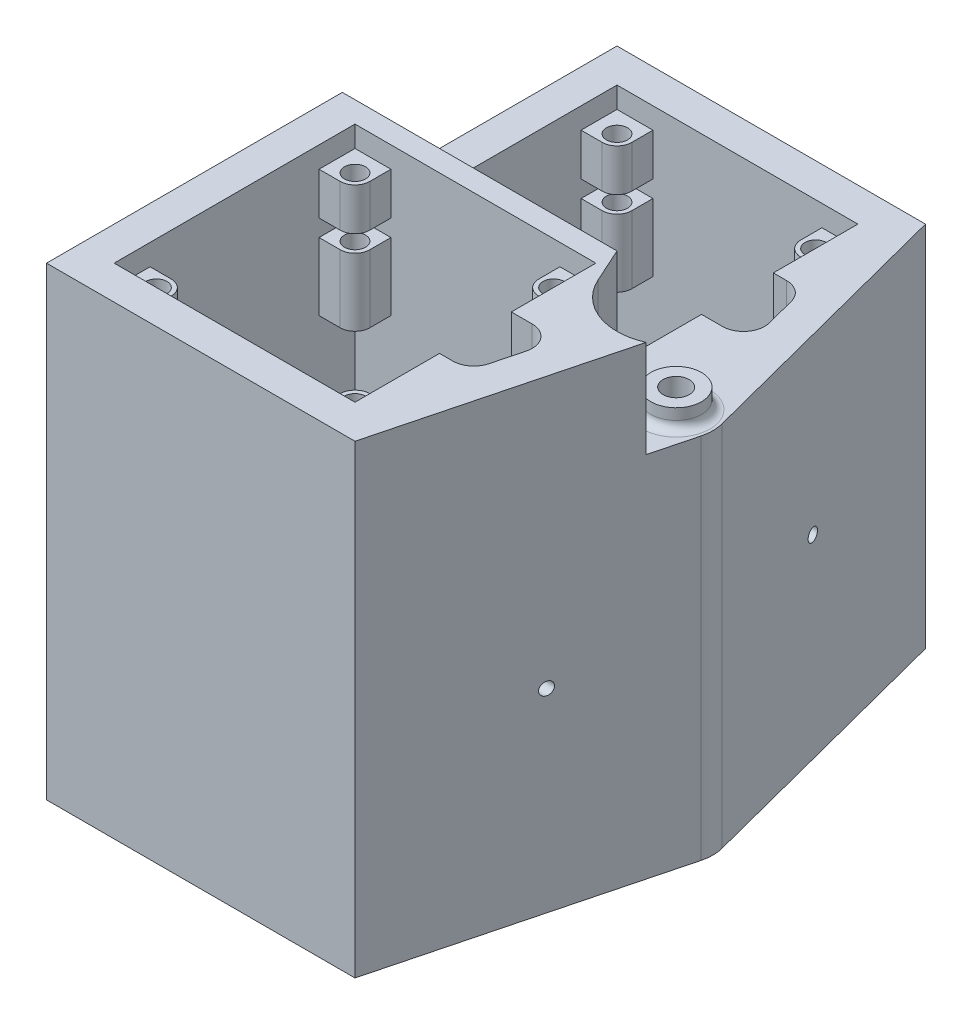
from build123d import *

# Parameters (mm, degrees)
SALIENTE_EXTRUIR1_DEPTH     = 110
CORTAR_EXTRUIR1_DEPTH       = 102
REDONDEO2_R                 = 5
CROQUIS3_W                  = 57
CROQUIS3_H                  = 57
CORTAR_EXTRUIR2_DEPTH       = 5
CROQUIS4_R                  = 6
CORTAR_EXTRUIR3_DEPTH       = 100
CROQUIS5_R                  = 3.1
CORTAR_EXTRUIR4_DEPTH       = 100
CORTAR_EXTRUIR5_START       = -32
CORTAR_EXTRUIR5_DEPTH       = 32
SALIENTE_EXTRUIR2_DEPTH     = 23
CORTAR_EXTRUIR6_DEPTH       = 102
CROQUIS10_W                 = 57
CROQUIS10_H                 = 57
CORTAR_EXTRUIR7_DEPTH       = 5
CORTAR_EXTRUIR8_DEPTH       = 189.690884782
CORTAR_EXTRUIR8_DEPTH_BACK  = 3
CROQUIS11_R                 = 63
CROQUIS12_R                 = 55
CORTAR_EXTRUIR9_DEPTH       = 13
CROQUIS13_R                 = 1.75
CORTAR_EXTRUIR10_DEPTH      = 14
CROQUIS14_R                 = 2.25
CORTAR_EXTRUIR11_DEPTH      = 5
MATRIZC1_COUNT              = 6
CROQUIS17_R                 = 2.5
CORTAR_EXTRUIR12_DEPTH      = 30
CROQUIS16_R                 = 2.5
CORTAR_EXTRUIR14_DEPTH      = 30
CORTAR_EXTRUIR16_DEPTH      = 202.102585802
CORTAR_EXTRUIR16_DEPTH_BACK = 202.102585802
CROQUIS22_R                 = 3
CORTAR_EXTRUIR17_START      = 30
CROQUIS23_R                 = 5
CORTAR_EXTRUIR17_DEPTH      = 193.025336429
CORTAR_EXTRUIR18_DEPTH      = 195.139769281
CROQUIS25_W                 = 40
CROQUIS25_H                 = 15
CORTAR_EXTRUIR19_DEPTH      = 223.025336392
CORTAR_EXTRUIR20_DEPTH      = 193.185457306
CORTAR_EXTRUIR21_REACH      = 224.025
CORTAR_EXTRUIR22_START      = 15
CORTAR_EXTRUIR22_DEPTH      = 15
CORTAR_EXTRUIR24_START      = -87.259259
CROQUIS29_W                 = 40
CROQUIS29_H                 = 15
CORTAR_EXTRUIR24_DEPTH      = 31.841835
CORTAR_EXTRUIR25_REACH      = 206.964
CROQUIS31_W                 = 56
CROQUIS31_H                 = 15
CORTAR_EXTRUIR26_DEPTH      = 3
CROQUIS32_R                 = 1.5
CORTAR_EXTRUIR27_DEPTH      = 10
CROQUIS33_R                 = 2.5
CORTAR_EXTRUIR28_DEPTH      = 195.139769239
CROQUIS34_R                 = 4.25
CORTAR_EXTRUIR29_DEPTH      = 5
CORTAR_EXTRUIR30_REACH      = 265.101
CROQUIS35_R                 = 2.5
CROQUIS36_R                 = 4.25
CORTAR_EXTRUIR31_DEPTH      = 5
SALIENTE_EXTRUIR3_START     = 4.6
CROQUIS38_R                 = 6
CROQUIS38_R_2               = 3.1
SALIENTE_EXTRUIR3_DEPTH     = 4.6
REDONDEO3_R                 = 2
CORTAR_EXTRUIR33_START      = -4
CORTAR_EXTRUIR33_DEPTH      = 2.2
CORTAR_EXTRUIR34_REACH      = 208.473
CORTAR_EXTRUIR35_START      = -30
CROQUIS41_W                 = 57
CROQUIS41_H                 = 57
CORTAR_EXTRUIR35_DEPTH      = 67
CORTAR_EXTRUIR36_START      = -84.320045
CROQUIS42_R                 = 1.5
CORTAR_EXTRUIR36_DEPTH      = 25.436686
CORTAR_EXTRUIR37_DEPTH      = 12
CROQUIS44_R                 = 3
CORTAR_EXTRUIR38_DEPTH      = 65
CORTAR_EXTRUIR39_DEPTH      = 223.025336392
CORTAR_EXTRUIR40_DEPTH      = 23
CORTAR_EXTRUIR41_DEPTH      = 97
CORTAR_EXTRUIR42_START      = -30
CROQUIS48_W                 = 57
CROQUIS48_H                 = 57
CORTAR_EXTRUIR42_DEPTH      = 67
CORTAR_EXTRUIR43_START      = -10
CROQUIS49_W                 = 57
CROQUIS49_H                 = 57
CORTAR_EXTRUIR43_DEPTH      = 4
CORTAR_EXTRUIR44_START      = -10
CORTAR_EXTRUIR44_DEPTH      = 4


with BuildPart() as part:
    # Croquis1 → Saliente-Extruir1 (new body)
    with BuildSketch(Plane(origin=(0, 0, 0), x_dir=(1, 0, 0), z_dir=(0, 1, 0))):
        with BuildLine():
            Line((-158, 67.5), (0, 67.5))
            ThreePointArc((0, 67.5), (67.5, 0), (0, -67.5))
            Line((0, -67.5), (-158, -67.5))
            Line((-158, -67.5), (-158, 67.5))
        make_face()
    extrude(amount=SALIENTE_EXTRUIR1_DEPTH)

    # Croquis2 → Cortar-Extruir1 (cut)
    with BuildSketch(Plane(origin=(0, 110, 0), x_dir=(1, 0, 0), z_dir=(0, 1, 0))):
        Polygon((-140, 59.5), (-103, 59.5), (-103, 49.5), (-93, 49.5), (-93, 12.5), (-103, 12.5), (-103, 2.5), (-140, 2.5), (-140, 12.5), (-150, 12.5), (-150, 49.5), (-140, 49.5), align=None)
    extrude(amount=-CORTAR_EXTRUIR1_DEPTH, mode=Mode.SUBTRACT)

    # Redondeo2
    redondeo2_edges = [part.edges().sort_by_distance(p)[0] for p in [
        (-140, 59, -12.5),
        (-140, 59, -49.5),
        (-103, 59, -49.5),
        (-103, 59, -12.5),
    ]]
    fillet(redondeo2_edges, radius=REDONDEO2_R)

    # Croquis3 → Cortar-Extruir2 (cut)
    with BuildSketch(Plane(origin=(0, 110, 0), x_dir=(1, 0, 0), z_dir=(0, 1, 0))):
        with Locations((-121.5, 31)):
            Rectangle(CROQUIS3_W, CROQUIS3_H)
    extrude(amount=-CORTAR_EXTRUIR2_DEPTH, mode=Mode.SUBTRACT)

    # Croquis4 → Cortar-Extruir3 (cut)
    with BuildSketch(Plane(origin=(0, 110, 0), x_dir=(1, 0, 0), z_dir=(0, 1, 0))):
        with Locations(Location((0, 0, 0), (0, 0, 270))):
            Circle(CROQUIS4_R)
    extrude(amount=-CORTAR_EXTRUIR3_DEPTH, mode=Mode.SUBTRACT)

    # Croquis5 → Cortar-Extruir4 (cut)
    with BuildSketch(Plane(origin=(0, 110, 0), x_dir=(1, 0, 0), z_dir=(0, 1, 0))):
        with Locations(Location((-76.5, 0, 0), (0, 0, 270))):
            Circle(CROQUIS5_R)
    extrude(amount=-CORTAR_EXTRUIR4_DEPTH, mode=Mode.SUBTRACT)

    # Croquis6 → Cortar-Extruir5 (cut)
    with BuildSketch(Plane(origin=(0, 110, 0), x_dir=(1, 0, 0), z_dir=(0, 1, 0)).offset(CORTAR_EXTRUIR5_START)):
        with BuildLine():
            Line((-68.150642634, 2.509621588), (-85, 67.5))
            Line((-85, 67.5), (0, 67.5))
            ThreePointArc((0, 67.5), (67.5, 0), (0, -67.5))
            Line((0, -67.5), (-85, -67.5))
            Line((-85, -67.5), (-68.150642634, -2.509621588))
            ThreePointArc((-68.150642634, -2.509621588), (-67.830611616, 0), (-68.150642634, 2.509621588))
        make_face()
    extrude(amount=CORTAR_EXTRUIR5_DEPTH, mode=Mode.SUBTRACT)

    # Croquis7 → Saliente-Extruir2 (add)
    with BuildSketch(Plane(origin=(0, 110, 0), x_dir=(1, 0, 0), z_dir=(0, 1, 0))):
        with BuildLine():
            Line((-70.817153658, -12.794735536), (-85, -67.5))
            Line((-85, -67.5), (-158, -67.5))
            Line((-158, -67.5), (-158, 2.5))
            Line((-158, 2.5), (-93, 2.5))
            Line((-93, 2.5), (-89.253692234, -5.774368745))
            ThreePointArc((-89.253692234, -5.774368745), (-81.482027989, -13.083554453), (-70.817153658, -12.794735536))
        make_face()
    extrude(amount=SALIENTE_EXTRUIR2_DEPTH)

    # Croquis8 → Cortar-Extruir6 (cut)
    with BuildSketch(Plane(origin=(0, 133, 0), x_dir=(1, 0, 0), z_dir=(0, 1, 0))):
        with BuildLine():
            Line((-103, -59.5), (-140, -59.5))
            Line((-140, -59.5), (-140, -54.5))
            ThreePointArc((-140, -54.5), (-141.464466094, -50.964466094), (-145, -49.5))
            Line((-145, -49.5), (-150, -49.5))
            Line((-150, -49.5), (-150, -12.5))
            Line((-150, -12.5), (-145, -12.5))
            ThreePointArc((-145, -12.5), (-141.464466094, -11.035533906), (-140, -7.5))
            Line((-140, -7.5), (-140, -2.5))
            Line((-140, -2.5), (-103, -2.5))
            Line((-103, -2.5), (-103, -7.5))
            ThreePointArc((-103, -7.5), (-101.535533906, -11.035533906), (-98, -12.5))
            Line((-98, -12.5), (-93, -12.5))
            Line((-93, -12.5), (-93, -49.5))
            Line((-93, -49.5), (-98, -49.5))
            ThreePointArc((-98, -49.5), (-101.535533906, -50.964466094), (-103, -54.5))
            Line((-103, -54.5), (-103, -59.5))
        make_face()
    extrude(amount=-CORTAR_EXTRUIR6_DEPTH, mode=Mode.SUBTRACT)

    # Croquis10 → Cortar-Extruir7 (cut)
    with BuildSketch(Plane(origin=(0, 133, 0), x_dir=(1, 0, 0), z_dir=(0, 1, 0))):
        with Locations((-121.5, -31)):
            Rectangle(CROQUIS10_W, CROQUIS10_H)
    extrude(amount=-CORTAR_EXTRUIR7_DEPTH, mode=Mode.SUBTRACT)

    # Croquis11 → Cortar-Extruir8 (cut, two sides: drawn at the far end of the back side and taken through both)
    with BuildSketch(Plane(origin=(0, 78, 0), x_dir=(1, 0, 0), z_dir=(0, 1, 0)).offset(-CORTAR_EXTRUIR8_DEPTH_BACK)):
        with Locations(Location((0, 0, 0), (0, 0, 270))):
            Circle(CROQUIS11_R)
    extrude(amount=CORTAR_EXTRUIR8_DEPTH + CORTAR_EXTRUIR8_DEPTH_BACK, mode=Mode.SUBTRACT)

    # Croquis12 → Cortar-Extruir9 (cut)
    with BuildSketch(Plane(origin=(0, 78, 0), x_dir=(1, 0, 0), z_dir=(0, 1, 0))):
        with Locations(Location((0, 0, 0), (0, 0, 270))):
            Circle(CROQUIS12_R)
    extrude(amount=-CORTAR_EXTRUIR9_DEPTH, mode=Mode.SUBTRACT)

    # Croquis13 → Cortar-Extruir10 (cut)
    with BuildSketch(Plane(origin=(0, 65, 0), x_dir=(1, 0, 0), z_dir=(0, 1, 0))):
        with Locations(Location((-37.5, 0, 0), (0, 0, 270))):
            Circle(CROQUIS13_R)
    cortar_extruir10 = extrude(amount=-CORTAR_EXTRUIR10_DEPTH, mode=Mode.SUBTRACT)

    # Croquis14 → Cortar-Extruir11 (cut)
    with BuildSketch(Plane(origin=(0, 65, 0), x_dir=(1, 0, 0), z_dir=(0, 1, 0))):
        with Locations(Location((-37.5, 0, 0), (0, 0, 270))):
            Circle(CROQUIS14_R)
    cortar_extruir11 = extrude(amount=-CORTAR_EXTRUIR11_DEPTH, mode=Mode.SUBTRACT)

    # MatrizC1: Cortar-Extruir10, Cortar-Extruir11 ×6 about axis
    matrizc1_axis = Axis((0, 0, 0), (0, 1, 0))
    add([cortar_extruir10.rotate(matrizc1_axis, i * 360 / MATRIZC1_COUNT) for i in range(1, MATRIZC1_COUNT)], mode=Mode.SUBTRACT)
    add([cortar_extruir11.rotate(matrizc1_axis, i * 360 / MATRIZC1_COUNT) for i in range(1, MATRIZC1_COUNT)], mode=Mode.SUBTRACT)

    # Croquis17 → Cortar-Extruir12 (cut)
    with BuildSketch(Plane(origin=(0, 133, 0), x_dir=(1, 0, 0), z_dir=(0, 1, 0))):
        with Locations(Location((-145, -7.5, 0), (0, 0, 270))):
            Circle(CROQUIS17_R)
        with Locations(Location((-98, -7.5, 0), (0, 0, 270))):
            Circle(CROQUIS17_R)
        with Locations(Location((-145, -54.5, 0), (0, 0, 270))):
            Circle(CROQUIS17_R)
        with Locations(Location((-98, -54.5, 0), (0, 0, 270))):
            Circle(CROQUIS17_R)
    extrude(amount=-CORTAR_EXTRUIR12_DEPTH, mode=Mode.SUBTRACT)

    # Croquis16 → Cortar-Extruir14 (cut)
    with BuildSketch(Plane(origin=(0, 110, 0), x_dir=(1, 0, 0), z_dir=(0, 1, 0))):
        with Locations(Location((-145, 54.5, 0), (0, 0, 270))):
            Circle(CROQUIS16_R)
        with Locations(Location((-98, 54.5, 0), (0, 0, 270))):
            Circle(CROQUIS16_R)
        with Locations(Location((-145, 7.5, 0), (0, 0, 270))):
            Circle(CROQUIS16_R)
        with Locations(Location((-98, 7.5, 0), (0, 0, 270))):
            Circle(CROQUIS16_R)
    extrude(amount=-CORTAR_EXTRUIR14_DEPTH, mode=Mode.SUBTRACT)

    # Barrer1: sweep along a path in Croquis20
    with BuildLine(Plane.XZ) as barrer1_path:
        Line((-158, -67.5), (0, -67.5))
        ThreePointArc((0, -67.5), (67.5, 0), (0, 67.5))
        Line((0, 67.5), (-158, 67.5))
    # Croquis21 → Barrer1 (sweep)
    with BuildSketch(Plane(origin=(-158, 0, 0), x_dir=(0, 0, -1), z_dir=(1, 0, 0))):
        with BuildLine():
            Line((-67.5, 0), (-81.5, 0))
            Line((-81.5, 0), (-81.5, 37.259500921))
            ThreePointArc((-81.5, 37.259500921), (-81.351889846, 38.974221441), (-80.911946708, 40.638148457))
            Line((-80.911946708, 40.638148457), (-67.5, 78))
            Line((-67.5, 78), (-67.5, 39))
            Line((-67.5, 39), (-67.5, 0))
        make_face()
    sweep(path=barrer1_path.line)

    # Croquis22 → Cortar-Extruir16 (cut, two sides: drawn at the far end of the back side and taken through both)
    with BuildSketch(Plane(origin=(0, 39, 0), x_dir=(-1, 0, 0), z_dir=(0, -1, 0)).offset(-CORTAR_EXTRUIR16_DEPTH_BACK)):
        with Locations(Location((118.5, 74.205973354, 0), (0, 0, 90))):
            Circle(CROQUIS22_R)
        with Locations(Location((39.5, 74.205973354, 0), (0, 0, 90))):
            Circle(CROQUIS22_R)
        with Locations(Location((-52.471546963, 52.471546963, 0), (0, 0, 90))):
            Circle(CROQUIS22_R)
        with Locations(Location((118.5, -74.205973354, 0), (0, 0, 270))):
            Circle(CROQUIS22_R)
        with Locations(Location((39.5, -74.205973354, 0), (0, 0, 270))):
            Circle(CROQUIS22_R)
        with Locations(Location((-52.471546963, -52.471546963, 0), (0, 0, 225))):
            Circle(CROQUIS22_R)
    extrude(amount=CORTAR_EXTRUIR16_DEPTH + CORTAR_EXTRUIR16_DEPTH_BACK, mode=Mode.SUBTRACT)

    # Croquis23 → Cortar-Extruir17 (cut, through all)
    with BuildSketch(Plane(origin=(0, 0, 0), x_dir=(1, 0, 0), z_dir=(0, 1, 0)).offset(CORTAR_EXTRUIR17_START)):
        with Locations(Location((-118.5, 74.205973354, 0), (0, 0, 90))):
            Circle(CROQUIS23_R)
        with Locations(Location((-39.5, 74.205973354, 0), (0, 0, 90))):
            Circle(CROQUIS23_R)
        with Locations(Location((52.471546963, 52.471546963, 0), (0, 0, 85.474739491))):
            Circle(CROQUIS23_R)
        with Locations(Location((52.471546963, -52.471546963, 0), (0, 0, 90))):
            Circle(CROQUIS23_R)
        with Locations(Location((-39.5, -74.205973354, 0), (0, 0, 90))):
            Circle(CROQUIS23_R)
        with Locations(Location((-118.5, -74.205973354, 0), (0, 0, 90))):
            Circle(CROQUIS23_R)
    extrude(amount=CORTAR_EXTRUIR17_DEPTH, mode=Mode.SUBTRACT)

    # Croquis24 → Cortar-Extruir18 (cut, through all)
    with BuildSketch(Plane(origin=(0, 78, 0), x_dir=(1, 0, 0), z_dir=(0, 1, 0))):
        with BuildLine():
            Line((0, 67.5), (0, 96.298683862))
            ThreePointArc((0, 96.298683862), (96.298683862, 0), (0, -96.298683862))
            Line((0, -96.298683862), (0, -67.5))
            ThreePointArc((0, -67.5), (-67.5, 0), (0, 67.5))
        make_face()
    extrude(amount=-CORTAR_EXTRUIR18_DEPTH, mode=Mode.SUBTRACT)

    # Croquis25 → Cortar-Extruir19 (cut, through all)
    with BuildSketch(Plane.ZY.offset(158)):
        with Locations((32.5, 15.5)):
            Rectangle(CROQUIS25_W, CROQUIS25_H)
    extrude(amount=-CORTAR_EXTRUIR19_DEPTH, mode=Mode.SUBTRACT)

    # Croquis26 → Cortar-Extruir20 (cut, through all)
    with BuildSketch(Plane(origin=(0, 60, 0), x_dir=(1, 0, 0), z_dir=(0, 1, 0))):
        with BuildLine():
            Line((-85, -67.5), (0, -67.5))
            Line((0, -67.5), (0, 67.5))
            Line((0, 67.5), (-85, 67.5))
            Line((-85, 67.5), (-68.150642634, 2.509621588))
            ThreePointArc((-68.150642634, 2.509621588), (-67.830611616, 0), (-68.150642634, -2.509621588))
            Line((-68.150642634, -2.509621588), (-70.817153658, -12.794735536))
            Line((-70.817153658, -12.794735536), (-85, -67.5))
        make_face()
    extrude(amount=-CORTAR_EXTRUIR20_DEPTH, mode=Mode.SUBTRACT)

    # Cortar-Extruir21: up to this face of the body (flat: up to its plane)
    cortar_extruir21_end = Plane(part.part.faces().sort_by_distance((-121.5, 8, -31))[0])
    # Croquis27 → Cortar-Extruir21 (cut, up to the picked face)
    with BuildSketch(Plane(origin=(0, 133, 0), x_dir=(1, 0, 0), z_dir=(0, 1, 0)), mode=Mode.PRIVATE) as cortar_extruir21_sk1:
        with BuildLine():
            Line((-93, -39.5), (-89.874239545, -39.5))
            ThreePointArc((-89.874239545, -39.5), (-86.814341995, -38.454368089), (-85.034255054, -35.754810794))
            Line((-85.034255054, -35.754810794), (-83.219440239, -28.754810794))
            ThreePointArc((-83.219440239, -28.754810794), (-84.105056641, -24.44010245), (-88.05942473, -22.5))
            Line((-88.05942473, -22.5), (-93, -22.5))
            Line((-93, -22.5), (-93, -39.5))
        make_face()
    cortar_extruir21_tool1 = split(extrude(cortar_extruir21_sk1.sketch, amount=-CORTAR_EXTRUIR21_REACH, mode=Mode.PRIVATE), bisect_by=cortar_extruir21_end, keep=Keep.BOTH, mode=Mode.PRIVATE)
    # Croquis27 → Cortar-Extruir21 (cut, up to the picked face)
    with BuildSketch(Plane(origin=(0, 133, 0), x_dir=(1, 0, 0), z_dir=(0, 1, 0)), mode=Mode.PRIVATE) as cortar_extruir21_sk2:
        with BuildLine():
            Line((-93, 22.5), (-93, 39.5))
            Line((-93, 39.5), (-89.874239545, 39.5))
            ThreePointArc((-89.874239545, 39.5), (-86.814341995, 38.454368089), (-85.034255054, 35.754810794))
            Line((-85.034255054, 35.754810794), (-83.219440239, 28.754810794))
            ThreePointArc((-83.219440239, 28.754810794), (-84.105056641, 24.44010245), (-88.05942473, 22.5))
            Line((-88.05942473, 22.5), (-93, 22.5))
        make_face()
    cortar_extruir21_tool2 = split(extrude(cortar_extruir21_sk2.sketch, amount=-CORTAR_EXTRUIR21_REACH, mode=Mode.PRIVATE), bisect_by=cortar_extruir21_end, keep=Keep.BOTH, mode=Mode.PRIVATE)
    add(cortar_extruir21_tool1.solids().sort_by(Axis((-88.665419, 133, 30.573819), (0, -1, 0)))[0], mode=Mode.SUBTRACT)
    add(cortar_extruir21_tool2.solids().sort_by(Axis((-88.665419, 133, -30.573819), (0, -1, 0)))[0], mode=Mode.SUBTRACT)

    # Croquis28 → Cortar-Extruir22 (cut)
    with BuildSketch(Plane(origin=(0, 8, 0), x_dir=(1, 0, 0), z_dir=(0, 1, 0)).offset(CORTAR_EXTRUIR22_START)):
        with BuildLine():
            Line((-83.219440239, 28.754810794), (-76.415131926, 2.509621588))
            ThreePointArc((-76.415131926, 2.509621588), (-76.095100908, 0), (-76.415131926, -2.509621588))
            Line((-76.415131926, -2.509621588), (-83.219440239, -28.754810794))
            Line((-83.219440239, -28.754810794), (-85.034255054, -35.754810794))
            ThreePointArc((-85.034255054, -35.754810794), (-86.814341995, -38.454368089), (-89.874239545, -39.5))
            Line((-89.874239545, -39.5), (-93, -39.5))
            Line((-93, -39.5), (-93, 39.5))
            Line((-93, 39.5), (-89.874239545, 39.5))
            ThreePointArc((-89.874239545, 39.5), (-86.814341995, 38.454368089), (-85.034255054, 35.754810794))
            Line((-85.034255054, 35.754810794), (-83.219440239, 28.754810794))
        make_face()
    extrude(amount=-CORTAR_EXTRUIR22_DEPTH, mode=Mode.SUBTRACT)

    # Croquis29 → Cortar-Extruir24 (cut)
    with BuildSketch(Plane.ZY.offset(158).offset(CORTAR_EXTRUIR24_START)):
        with Locations((-32.5, 15.5)):
            Rectangle(CROQUIS29_W, CROQUIS29_H)
    extrude(amount=CORTAR_EXTRUIR24_DEPTH, mode=Mode.SUBTRACT)

    # Croquis30 → Cortar-Extruir25 (cut, up to next)
    with BuildSketch(Plane(origin=(0, 31, 0), x_dir=(1, 0, 0), z_dir=(0, 1, 0)), mode=Mode.PRIVATE) as cortar_extruir25_sk1:
        with BuildLine():
            Line((-132, -52.5), (-111, -52.5))
            ThreePointArc((-111, -52.5), (-105.343145751, -50.156854249), (-103, -44.5))
            Line((-103, -44.5), (-103, -20.5))
            ThreePointArc((-103, -20.5), (-105.343145751, -14.843145751), (-111, -12.5))
            Line((-111, -12.5), (-132, -12.5))
            ThreePointArc((-132, -12.5), (-137.656854249, -14.843145751), (-140, -20.5))
            Line((-140, -20.5), (-140, -44.5))
            ThreePointArc((-140, -44.5), (-137.656854249, -50.156854249), (-132, -52.5))
        make_face()
    cortar_extruir25_tool1 = extrude(cortar_extruir25_sk1.sketch, amount=-CORTAR_EXTRUIR25_REACH, mode=Mode.PRIVATE) & part.part
    add(cortar_extruir25_tool1.solids().sort_by_distance((-121.5, 31, 32.5))[0], mode=Mode.SUBTRACT)

    # Croquis31 → Cortar-Extruir26 (cut)
    with BuildSketch(Plane.ZY.offset(158)):
        with Locations((32.5, 15.5)):
            Rectangle(CROQUIS31_W, CROQUIS31_H)
    extrude(amount=-CORTAR_EXTRUIR26_DEPTH, mode=Mode.SUBTRACT)

    # Croquis32 → Cortar-Extruir27 (cut)
    with BuildSketch(Plane.ZY.offset(155)):
        with Locations((8.5, 15.5)):
            Circle(CROQUIS32_R)
        with Locations(Location((56.5, 15.5, 0), (0, 0, 180))):
            Circle(CROQUIS32_R)
    extrude(amount=-CORTAR_EXTRUIR27_DEPTH, mode=Mode.SUBTRACT)

    # Croquis33 → Cortar-Extruir28 (cut, through all)
    with BuildSketch(Plane(origin=(0, 78, 0), x_dir=(1, 0, 0), z_dir=(0, 1, 0))):
        with Locations(Location((-70.010673469, 57.5, 0), (0, 0, 270))):
            Circle(CROQUIS33_R)
        with Locations(Location((-65.344006802, 39.5, 0), (0, 0, 270))):
            Circle(CROQUIS33_R)
        with Locations(Location((-65.344006802, -39.5, 0), (0, 0, 270))):
            Circle(CROQUIS33_R)
        with Locations(Location((-70.010673469, -57.5, 0), (0, 0, 270))):
            Circle(CROQUIS33_R)
    extrude(amount=-CORTAR_EXTRUIR28_DEPTH, mode=Mode.SUBTRACT)

    # Croquis34 → Cortar-Extruir29 (cut)
    with BuildSketch(Plane(origin=(0, 78, 0), x_dir=(1, 0, 0), z_dir=(0, 1, 0))):
        with Locations(Location((-70.010673469, 57.5, 0), (0, 0, 270))):
            Circle(CROQUIS34_R)
        with Locations(Location((-65.344006802, 39.5, 0), (0, 0, 270))):
            Circle(CROQUIS34_R)
        with Locations(Location((-65.344006802, -39.5, 0), (0, 0, 270))):
            Circle(CROQUIS34_R)
        with Locations(Location((-70.010673469, -57.5, 0), (0, 0, 270))):
            Circle(CROQUIS34_R)
    extrude(amount=-CORTAR_EXTRUIR29_DEPTH, mode=Mode.SUBTRACT)

    # Croquis35 → Cortar-Extruir30 (cut, up to next)
    with BuildSketch(Plane(origin=(0, 0, -81.5), x_dir=(-1, 0, 0), z_dir=(0, 0, -1)), mode=Mode.PRIVATE) as cortar_extruir30_sk1:
        with Locations((12, 28)):
            Circle(CROQUIS35_R)
    cortar_extruir30_tool1 = extrude(cortar_extruir30_sk1.sketch, amount=-CORTAR_EXTRUIR30_REACH, mode=Mode.PRIVATE) & part.part
    # Croquis35 → Cortar-Extruir30 (cut, up to next)
    with BuildSketch(Plane(origin=(0, 0, -81.5), x_dir=(-1, 0, 0), z_dir=(0, 0, -1)), mode=Mode.PRIVATE) as cortar_extruir30_sk2:
        with Locations((12, 10)):
            Circle(CROQUIS35_R)
    cortar_extruir30_tool2 = extrude(cortar_extruir30_sk2.sketch, amount=-CORTAR_EXTRUIR30_REACH, mode=Mode.PRIVATE) & part.part
    cortar_extruir30_1 = cortar_extruir30_tool1.solids().sort_by_distance((-12, 28, -81.5))[0]
    add(cortar_extruir30_1, mode=Mode.SUBTRACT)
    cortar_extruir30_2 = cortar_extruir30_tool2.solids().sort_by_distance((-12, 10, -81.5))[0]
    add(cortar_extruir30_2, mode=Mode.SUBTRACT)
    cortar_extruir30 = cortar_extruir30_1 + cortar_extruir30_2  # Cortar-Extruir30 as one shape, for the pattern or mirror that repeats it

    # Croquis36 → Cortar-Extruir31 (cut)
    with BuildSketch(Plane(origin=(0, 0, -81.5), x_dir=(-1, 0, 0), z_dir=(0, 0, -1))):
        with Locations((12, 28)):
            Circle(CROQUIS36_R)
        with Locations((12, 10)):
            Circle(CROQUIS36_R)
    cortar_extruir31 = extrude(amount=-CORTAR_EXTRUIR31_DEPTH, mode=Mode.SUBTRACT)

    # Simetría2: Cortar-Extruir30, Cortar-Extruir31 across plane
    add(cortar_extruir30.mirror(Plane(origin=(0, 0, 0), x_dir=(1, 0, 0), z_dir=(0, 0, -1))), mode=Mode.SUBTRACT)
    add(cortar_extruir31.mirror(Plane(origin=(0, 0, 0), x_dir=(1, 0, 0), z_dir=(0, 0, -1))), mode=Mode.SUBTRACT)

    # Croquis38 → Saliente-Extruir3 (add)
    with BuildSketch(Plane(origin=(0, 110, 0), x_dir=(1, 0, 0), z_dir=(0, 1, 0)).offset(SALIENTE_EXTRUIR3_START)):
        with Locations(Location((-76.5, 0, 0), (0, 0, 270))):
            Circle(CROQUIS38_R)
        with Locations(Location((-76.5, 0, 0), (0, 0, 270))):
            Circle(CROQUIS38_R_2, mode=Mode.SUBTRACT)
    extrude(amount=-SALIENTE_EXTRUIR3_DEPTH)

    # Redondeo3
    redondeo3_edges = [part.edges().sort_by_distance(p)[0] for p in [
        (-76.5, 110, -6),
    ]]
    fillet(redondeo3_edges, radius=REDONDEO3_R)

    # Croquis39 → Cortar-Extruir33 (cut)
    with BuildSketch(Plane.ZY.offset(155).offset(CORTAR_EXTRUIR33_START)):
        Polygon((4.602885683, 15.5), (6.551442841, 12.125), (12.5, 12.125), (12.5, 18.875), (6.551442841, 18.875), align=None)
        Polygon((52.5, 18.875), (52.5, 12.125), (58.448557159, 12.125), (60.397114317, 15.5), (58.448557159, 18.875), align=None)
    extrude(amount=-CORTAR_EXTRUIR33_DEPTH, mode=Mode.SUBTRACT)

    # Cortar-Extruir34: up to this face of the body (flat: up to its plane)
    cortar_extruir34_end = Plane(part.part.faces().sort_by_distance((-156.5, 8, 5.983717572))[0])
    # Croquis40 → Cortar-Extruir34 (cut, up to the picked face)
    with BuildSketch(Plane(origin=(0, 105, 0), x_dir=(1, 0, 0), z_dir=(0, 1, 0)), mode=Mode.PRIVATE) as cortar_extruir34_sk1:
        with BuildLine():
            Line((-141.5, 59.5), (-141.5, 54.5))
            ThreePointArc((-141.5, 54.5), (-142.525126266, 52.025126266), (-145, 51))
            Line((-145, 51), (-150, 51))
            Line((-150, 51), (-150, 11))
            Line((-150, 11), (-145, 11))
            ThreePointArc((-145, 11), (-142.525126266, 9.974873734), (-141.5, 7.5))
            Line((-141.5, 7.5), (-141.5, 2.5))
            Line((-141.5, 2.5), (-101.5, 2.5))
            Line((-101.5, 2.5), (-101.5, 7.5))
            ThreePointArc((-101.5, 7.5), (-100.474873734, 9.974873734), (-98, 11))
            Line((-98, 11), (-93, 11))
            Line((-93, 11), (-93, 51))
            Line((-93, 51), (-98, 51))
            ThreePointArc((-98, 51), (-100.474873734, 52.025126266), (-101.5, 54.5))
            Line((-101.5, 54.5), (-101.5, 59.5))
            Line((-101.5, 59.5), (-141.5, 59.5))
        make_face()
    cortar_extruir34_tool1 = split(extrude(cortar_extruir34_sk1.sketch, amount=-CORTAR_EXTRUIR34_REACH, mode=Mode.PRIVATE), bisect_by=cortar_extruir34_end, keep=Keep.BOTH, mode=Mode.PRIVATE)
    add(cortar_extruir34_tool1.solids().sort_by(Axis((-121.5, 105, -31), (0, -1, 0)))[0], mode=Mode.SUBTRACT)

    # Croquis41 → Cortar-Extruir35 (cut)
    with BuildSketch(Plane(origin=(0, 105, 0), x_dir=(1, 0, 0), z_dir=(0, 1, 0)).offset(CORTAR_EXTRUIR35_START)):
        with Locations((-121.5, 31)):
            Rectangle(CROQUIS41_W, CROQUIS41_H)
    extrude(amount=-CORTAR_EXTRUIR35_DEPTH, mode=Mode.SUBTRACT)

    # Croquis42 → Cortar-Extruir36 (cut)
    with BuildSketch(Plane(origin=(0, 0, 0), x_dir=(0, 0, -1), z_dir=(1, 0, 0)).offset(CORTAR_EXTRUIR36_START)):
        with Locations((31.5, 69)):
            Circle(CROQUIS42_R)
        with Locations((-31.5, 69)):
            Circle(CROQUIS42_R)
    extrude(amount=CORTAR_EXTRUIR36_DEPTH, mode=Mode.SUBTRACT)

    # Croquis43 → Cortar-Extruir37 (cut)
    with BuildSketch(Plane.ZY.offset(93)):
        Polygon((-27.74722325, 69), (-29.623611625, 72.25), (-33.376388375, 72.25), (-35.25277675, 69), (-33.376388375, 65.75), (-29.623611625, 65.75), align=None)
        Polygon((29.623611625, 65.75), (27.74722325, 69), (29.623611625, 72.25), (33.376388375, 72.25), (35.25277675, 69), (33.376388375, 65.75), align=None)
    extrude(amount=-CORTAR_EXTRUIR37_DEPTH, mode=Mode.SUBTRACT)

    # Croquis44 → Cortar-Extruir38 (cut)
    with BuildSketch(Plane(origin=(0, 0, 0), x_dir=(0, 0, -1), z_dir=(1, 0, 0))):
        with Locations((31.5, 69)):
            Circle(CROQUIS44_R)
        with Locations((-31.5, 69)):
            Circle(CROQUIS44_R)
    extrude(amount=-CORTAR_EXTRUIR38_DEPTH, mode=Mode.SUBTRACT)

    # Croquis45 → Cortar-Extruir39 (cut, through all)
    with BuildSketch(Plane(origin=(0, 133, 0), x_dir=(1, 0, 0), z_dir=(0, 1, 0))):
        with BuildLine():
            Line((-158, -67.5), (-85, -67.5))
            Line((-85, -67.5), (-70.817153658, -12.794735536))
            Line((-70.817153658, -12.794735536), (-68.150642634, -2.509621588))
            ThreePointArc((-68.150642634, -2.509621588), (-67.830611616, 0), (-68.150642634, 2.509621588))
            Line((-68.150642634, 2.509621588), (-85, 67.5))
            Line((-85, 67.5), (-158, 67.5))
            add(Edge.make_bspline(
                [(-158, 67.5), (-225.196953109, 141.295845253), (92.474712565, 209.648968186), (97.38463856, -188.541965216), (-239.886153538, -136.857036311), (-158, -67.5)],
                knots=[0, 0, 0, 0, 0.321989349, 0.67256184, 1, 1, 1, 1], degree=3))
        make_face()
    extrude(amount=-CORTAR_EXTRUIR39_DEPTH, mode=Mode.SUBTRACT)

    # Croquis46 → Cortar-Extruir40 (cut)
    with BuildSketch(Plane.XZ):
        with BuildLine():
            Line((-158, -67.5), (-158, 67.5))
            Line((-158, 67.5), (-85, 67.5))
            Line((-85, 67.5), (-68.150642634, 2.509621588))
            ThreePointArc((-68.150642634, 2.509621588), (-67.830611616, 0), (-68.150642634, -2.509621588))
            Line((-68.150642634, -2.509621588), (-85, -67.5))
            Line((-85, -67.5), (-158, -67.5))
        make_face()
    extrude(amount=-CORTAR_EXTRUIR40_DEPTH, mode=Mode.SUBTRACT)

    # Croquis47 → Cortar-Extruir41 (cut)
    with BuildSketch(Plane(origin=(0, 128, 0), x_dir=(1, 0, 0), z_dir=(0, 1, 0))):
        with BuildLine():
            Line((-145, -11), (-150, -11))
            Line((-150, -11), (-150, -51))
            Line((-150, -51), (-145, -51))
            ThreePointArc((-145, -51), (-142.525126266, -52.025126266), (-141.5, -54.5))
            Line((-141.5, -54.5), (-141.5, -59.5))
            Line((-141.5, -59.5), (-101.5, -59.5))
            Line((-101.5, -59.5), (-101.5, -54.5))
            ThreePointArc((-101.5, -54.5), (-100.474873734, -52.025126266), (-98, -51))
            Line((-98, -51), (-93, -51))
            Line((-93, -51), (-93, -11))
            Line((-93, -11), (-98, -11))
            ThreePointArc((-98, -11), (-100.474873734, -9.974873734), (-101.5, -7.5))
            Line((-101.5, -7.5), (-101.5, -2.5))
            Line((-101.5, -2.5), (-141.5, -2.5))
            Line((-141.5, -2.5), (-141.5, -7.5))
            ThreePointArc((-141.5, -7.5), (-142.525126266, -9.974873734), (-145, -11))
        make_face()
    extrude(amount=-CORTAR_EXTRUIR41_DEPTH, mode=Mode.SUBTRACT)

    # Croquis48 → Cortar-Extruir42 (cut)
    with BuildSketch(Plane(origin=(0, 128, 0), x_dir=(1, 0, 0), z_dir=(0, 1, 0)).offset(CORTAR_EXTRUIR42_START)):
        with Locations((-121.5, -31)):
            Rectangle(CROQUIS48_W, CROQUIS48_H)
    extrude(amount=-CORTAR_EXTRUIR42_DEPTH, mode=Mode.SUBTRACT)

    # Croquis49 → Cortar-Extruir43 (cut)
    with BuildSketch(Plane(origin=(0, 105, 0), x_dir=(1, 0, 0), z_dir=(0, 1, 0)).offset(CORTAR_EXTRUIR43_START)):
        with Locations((-121.5, 31)):
            Rectangle(CROQUIS49_W, CROQUIS49_H)
    extrude(amount=-CORTAR_EXTRUIR43_DEPTH, mode=Mode.SUBTRACT)

    # Croquis50 → Cortar-Extruir44 (cut)
    with BuildSketch(Plane(origin=(0, 128, 0), x_dir=(1, 0, 0), z_dir=(0, 1, 0)).offset(CORTAR_EXTRUIR44_START)):
        Polygon((-150, -59.5), (-93, -59.5), (-93, -39.5), (-93, -22.5), (-93, -2.5), (-150, -2.5), align=None)
    extrude(amount=-CORTAR_EXTRUIR44_DEPTH, mode=Mode.SUBTRACT)


solid = part.part
